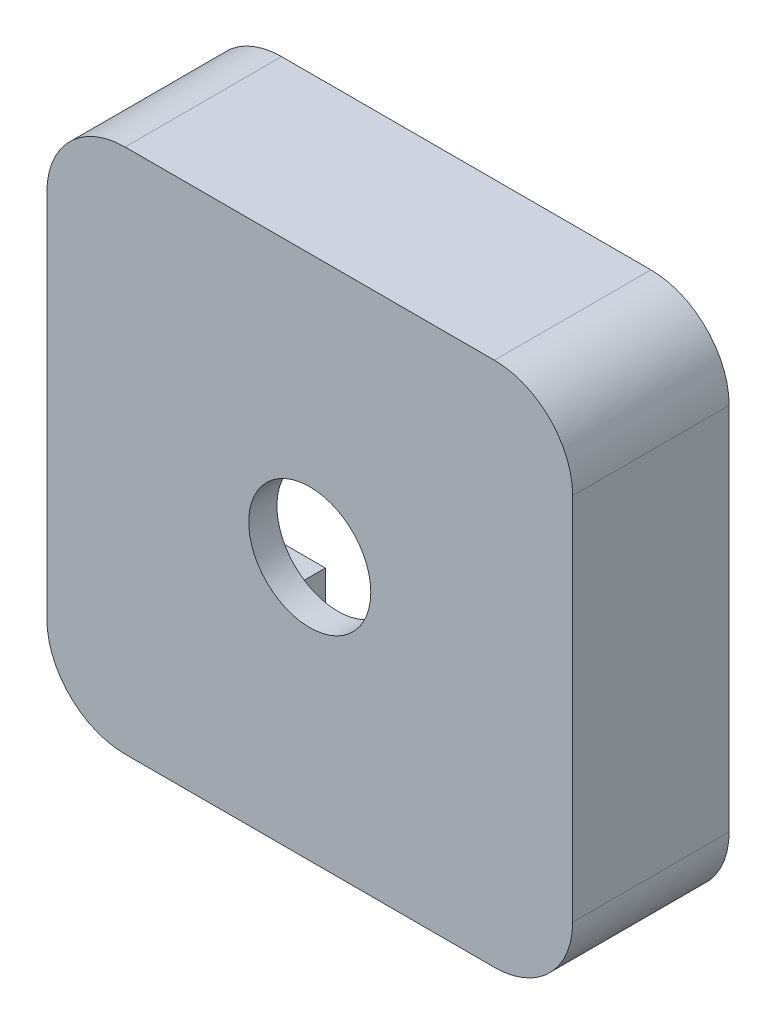
from build123d import *

# Parameters (mm, degrees)
SKETCH1_W           = 25.2
SKETCH1_H           = 24.9
SKETCH1_R           = 3.9
BOSS_EXTRUDE5_DEPTH = 1.8
SKETCH1_3_W         = 33.6
SKETCH1_3_H         = 33.6
SKETCH1_3_W_2       = 25.2
SKETCH1_3_H_2       = 24.9
BOSS_EXTRUDE6_DEPTH = 10
FILLET1_R           = 5
SKETCH3_W           = 18
SKETCH3_H           = 6.7
CUT_EXTRUDE1_DEPTH  = 3.8


with BuildPart() as part:
    # Sketch1 → Boss-Extrude5 (new body)
    with BuildSketch(Plane.XY):
        with Locations((-0.721052632, -0.003756028)):
            Rectangle(SKETCH1_W, SKETCH1_H)
        with Locations((-0.721052632, -2.353756028)):
            Circle(SKETCH1_R, mode=Mode.SUBTRACT)
    extrude(amount=-BOSS_EXTRUDE5_DEPTH)

    # Sketch1<3> → Boss-Extrude6 (add)
    with BuildSketch(Plane.XY):
        with Locations((-0.721052632, -2.353756028)):
            Rectangle(SKETCH1_3_W, SKETCH1_3_H)
        with Locations((-0.721052632, -0.003756028)):
            Rectangle(SKETCH1_3_W_2, SKETCH1_3_H_2, mode=Mode.SUBTRACT)
    extrude(amount=-BOSS_EXTRUDE6_DEPTH)

    # Fillet1
    fillet1_edges = [part.edges().sort_by_distance(p)[0] for p in [
        (-17.521052632, -19.153756028, -5),
        (16.078947368, -19.153756028, -5),
        (16.078947368, 14.446243972, -5),
        (-17.521052632, 14.446243972, -5),
    ]]
    fillet(fillet1_edges, radius=FILLET1_R)

    # Sketch3 → Cut-Extrude1 (cut)
    with BuildSketch(Plane(origin=(0, 0, -10), x_dir=(-1, 0, 0), z_dir=(0, 0, -1))):
        with Locations((0.721052632, -15.803756028)):
            Rectangle(SKETCH3_W, SKETCH3_H)
    extrude(amount=-CUT_EXTRUDE1_DEPTH, mode=Mode.SUBTRACT)


solid = part.part
